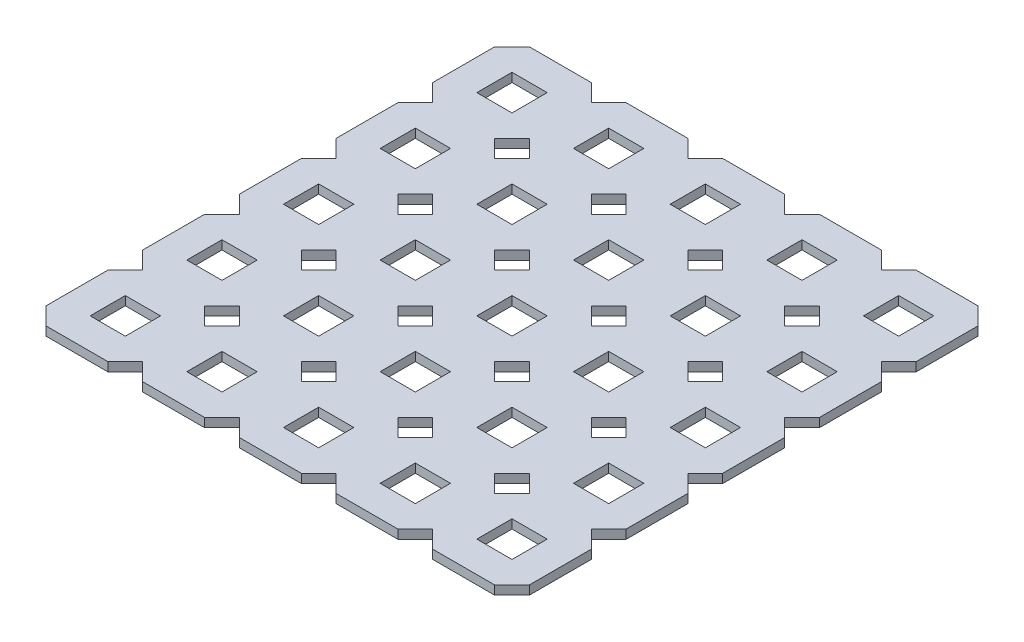
from build123d import *

# Parameters (mm, degrees)
SKETCH1_W           = 4.6228
SKETCH1_H           = 4.6228
BOSS_EXTRUDE1_DEPTH = 1.1684


with BuildPart() as part:
    # Sketch1 → Boss-Extrude1 (new body)
    with BuildSketch(Plane(origin=(0, 1.1684, 0), x_dir=(1, 0, 0), z_dir=(0, 1, 0))):
        Polygon((14.980985055, 127), (12.7, 124.719014945), (10.419014945, 127), (2.280985055, 127), (0, 124.719014945), (0, 116.580985055), (2.280985055, 114.3), (0, 112.019014945), (0, 103.880985055), (2.280985055, 101.6), (0, 99.319014945), (0, 91.180985055), (2.280985055, 88.9), (0, 86.619014945), (0, 78.480985055), (2.280985055, 76.2), (0, 73.919014945), (0, 65.780985055), (2.280985055, 63.5), (10.419014945, 63.5), (12.7, 65.780985055), (14.980985055, 63.5), (23.119014945, 63.5), (25.4, 65.780985055), (27.680985055, 63.5), (35.819014945, 63.5), (38.1, 65.780985055), (40.380985055, 63.5), (48.519014945, 63.5), (50.8, 65.780985055), (53.080985055, 63.5), (61.219014945, 63.5), (63.5, 65.780985055), (63.5, 73.919014945), (61.219014945, 76.2), (63.5, 78.480985055), (63.5, 86.619014945), (61.219014945, 88.9), (63.5, 91.180985055), (63.5, 99.319014945), (61.219014945, 101.6), (63.5, 103.880985055), (63.5, 112.019014945), (61.219014945, 114.3), (63.5, 116.580985055), (63.5, 124.719014945), (61.219014945, 127), (53.080985055, 127), (50.8, 124.719014945), (48.519014945, 127), (40.380985055, 127), (38.1, 124.719014945), (35.819014945, 127), (27.680985055, 127), (25.4, 124.719014945), (23.119014945, 127), align=None)
        Polygon((12.7, 112.019014945), (10.419014945, 114.3), (12.7, 116.580985055), (14.980985055, 114.3), align=None, mode=Mode.SUBTRACT)
        Polygon((12.7, 86.619014945), (10.419014945, 88.9), (12.7, 91.180985055), (14.980985055, 88.9), align=None, mode=Mode.SUBTRACT)
        Polygon((25.4, 112.019014945), (23.119014945, 114.3), (25.4, 116.580985055), (27.680985055, 114.3), align=None, mode=Mode.SUBTRACT)
        Polygon((25.4, 86.619014945), (23.119014945, 88.9), (25.4, 91.180985055), (27.680985055, 88.9), align=None, mode=Mode.SUBTRACT)
        Polygon((38.1, 112.019014945), (35.819014945, 114.3), (38.1, 116.580985055), (40.380985055, 114.3), align=None, mode=Mode.SUBTRACT)
        Polygon((38.1, 86.619014945), (35.819014945, 88.9), (38.1, 91.180985055), (40.380985055, 88.9), align=None, mode=Mode.SUBTRACT)
        Polygon((50.8, 112.019014945), (48.519014945, 114.3), (50.8, 116.580985055), (53.080985055, 114.3), align=None, mode=Mode.SUBTRACT)
        Polygon((50.8, 86.619014945), (48.519014945, 88.9), (50.8, 91.180985055), (53.080985055, 88.9), align=None, mode=Mode.SUBTRACT)
        with Locations((6.35, 120.65)):
            Rectangle(SKETCH1_W, SKETCH1_H, mode=Mode.SUBTRACT)
        with Locations((19.05, 120.65)):
            Rectangle(SKETCH1_W, SKETCH1_H, mode=Mode.SUBTRACT)
        with Locations((31.75, 120.65)):
            Rectangle(SKETCH1_W, SKETCH1_H, mode=Mode.SUBTRACT)
        with Locations((44.45, 120.65)):
            Rectangle(SKETCH1_W, SKETCH1_H, mode=Mode.SUBTRACT)
        with Locations((57.15, 120.65)):
            Rectangle(SKETCH1_W, SKETCH1_H, mode=Mode.SUBTRACT)
        with Locations((6.35, 107.95)):
            Rectangle(SKETCH1_W, SKETCH1_H, mode=Mode.SUBTRACT)
        with Locations((57.15, 107.95)):
            Rectangle(SKETCH1_W, SKETCH1_H, mode=Mode.SUBTRACT)
        with Locations((6.35, 95.25)):
            Rectangle(SKETCH1_W, SKETCH1_H, mode=Mode.SUBTRACT)
        with Locations((57.15, 95.25)):
            Rectangle(SKETCH1_W, SKETCH1_H, mode=Mode.SUBTRACT)
        with Locations((6.35, 82.55)):
            Rectangle(SKETCH1_W, SKETCH1_H, mode=Mode.SUBTRACT)
        with Locations((57.15, 82.55)):
            Rectangle(SKETCH1_W, SKETCH1_H, mode=Mode.SUBTRACT)
        with Locations((6.35, 69.85)):
            Rectangle(SKETCH1_W, SKETCH1_H, mode=Mode.SUBTRACT)
        with Locations((57.15, 69.85)):
            Rectangle(SKETCH1_W, SKETCH1_H, mode=Mode.SUBTRACT)
        with Locations((19.05, 107.95)):
            Rectangle(SKETCH1_W, SKETCH1_H, mode=Mode.SUBTRACT)
        with Locations((31.75, 107.95)):
            Rectangle(SKETCH1_W, SKETCH1_H, mode=Mode.SUBTRACT)
        with Locations((44.45, 107.95)):
            Rectangle(SKETCH1_W, SKETCH1_H, mode=Mode.SUBTRACT)
        with Locations((19.05, 95.25)):
            Rectangle(SKETCH1_W, SKETCH1_H, mode=Mode.SUBTRACT)
        with Locations((31.75, 95.25)):
            Rectangle(SKETCH1_W, SKETCH1_H, mode=Mode.SUBTRACT)
        with Locations((44.45, 95.25)):
            Rectangle(SKETCH1_W, SKETCH1_H, mode=Mode.SUBTRACT)
        with Locations((19.05, 82.55)):
            Rectangle(SKETCH1_W, SKETCH1_H, mode=Mode.SUBTRACT)
        with Locations((31.75, 82.55)):
            Rectangle(SKETCH1_W, SKETCH1_H, mode=Mode.SUBTRACT)
        with Locations((44.45, 82.55)):
            Rectangle(SKETCH1_W, SKETCH1_H, mode=Mode.SUBTRACT)
        with Locations((19.05, 69.85)):
            Rectangle(SKETCH1_W, SKETCH1_H, mode=Mode.SUBTRACT)
        with Locations((31.75, 69.85)):
            Rectangle(SKETCH1_W, SKETCH1_H, mode=Mode.SUBTRACT)
        with Locations((44.45, 69.85)):
            Rectangle(SKETCH1_W, SKETCH1_H, mode=Mode.SUBTRACT)
        Polygon((50.8, 73.919014945), (48.519014945, 76.2), (50.8, 78.480985055), (53.080985055, 76.2), align=None, mode=Mode.SUBTRACT)
        Polygon((50.8, 99.319014945), (48.519014945, 101.6), (50.8, 103.880985055), (53.080985055, 101.6), align=None, mode=Mode.SUBTRACT)
        Polygon((38.1, 73.919014945), (35.819014945, 76.2), (38.1, 78.480985055), (40.380985055, 76.2), align=None, mode=Mode.SUBTRACT)
        Polygon((38.1, 99.319014945), (35.819014945, 101.6), (38.1, 103.880985055), (40.380985055, 101.6), align=None, mode=Mode.SUBTRACT)
        Polygon((25.4, 73.919014945), (23.119014945, 76.2), (25.4, 78.480985055), (27.680985055, 76.2), align=None, mode=Mode.SUBTRACT)
        Polygon((25.4, 99.319014945), (23.119014945, 101.6), (25.4, 103.880985055), (27.680985055, 101.6), align=None, mode=Mode.SUBTRACT)
        Polygon((12.7, 73.919014945), (10.419014945, 76.2), (12.7, 78.480985055), (14.980985055, 76.2), align=None, mode=Mode.SUBTRACT)
        Polygon((12.7, 99.319014945), (10.419014945, 101.6), (12.7, 103.880985055), (14.980985055, 101.6), align=None, mode=Mode.SUBTRACT)
    extrude(amount=-BOSS_EXTRUDE1_DEPTH)


solid = part.part
